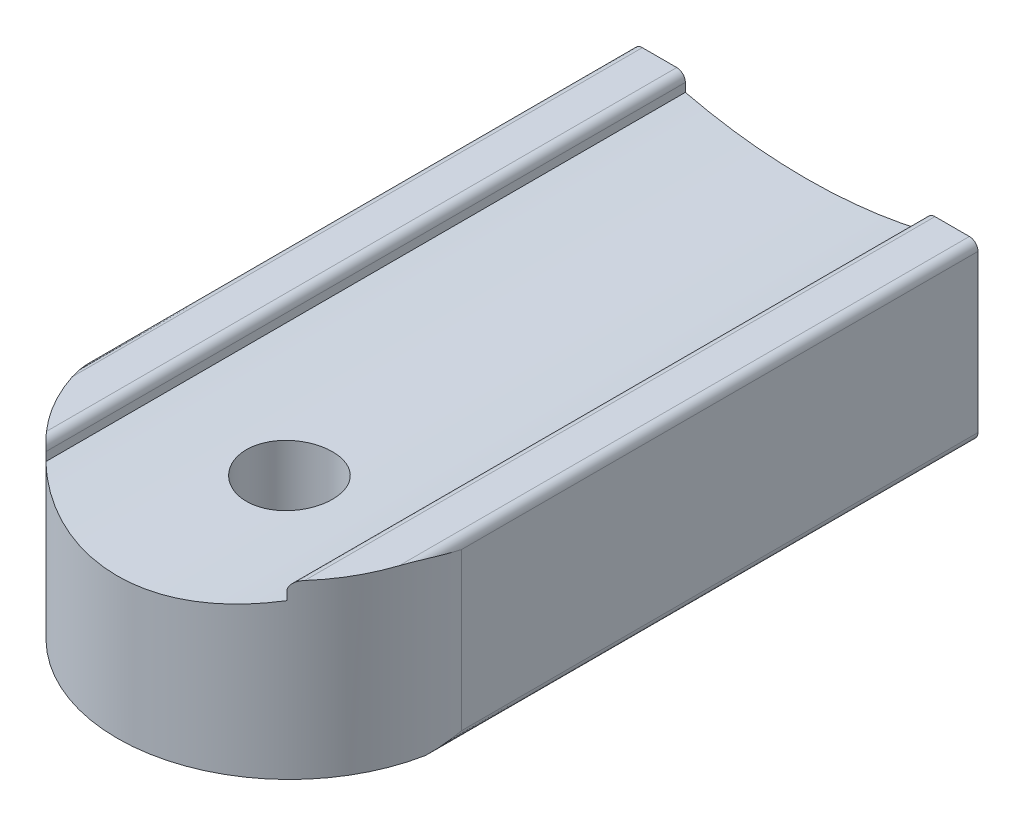
from build123d import *

# Parameters (mm, degrees)
SALIENTE_EXTRUIR1_DEPTH = 40
CROQUIS2_R              = 2.5
CORTAR_EXTRUIR1_DEPTH   = 22.5
CORTAR_EXTRUIR5_DEPTH   = 14
CROQUIS6_R              = 4
CROQUIS6_R_2            = 2.5
SALIENTE_EXTRUIR2_DEPTH = 1


with BuildPart() as part:
    # Croquis1 → Saliente-Extruir1 (new body)
    with BuildSketch(Plane.XY):
        with BuildLine():
            ThreePointArc((-13.23096405, 11.648445498), (-13.584517441, 11.501998889), (-13.73096405, 11.148445498))
            Line((-13.73096405, 11.148445498), (-13.73096405, 2.035658412))
            ThreePointArc((-13.73096405, 2.035658412), (-13.626281451, 1.729514406), (-13.356067441, 1.551562201))
            Line((-13.356067441, 1.551562201), (-12.169475815, 1.244915231))
            ThreePointArc((-12.169475815, 1.244915231), (-11.899261805, 1.066963026), (-11.794579206, 0.76081902))
            Line((-11.794579206, 0.76081902), (-11.794579206, 0.442917518))
            ThreePointArc((-11.794579206, 0.442917518), (-11.736179814, 0.265071669), (-11.583718232, 0.156466416))
            ThreePointArc((-11.583718232, 0.156466416), (-7.701884055, -0.773383829), (-3.73096405, -1.17965021))
            ThreePointArc((-3.73096405, -1.17965021), (0.239955955, -0.773383829), (4.121790132, 0.156466416))
            ThreePointArc((4.121790132, 0.156466416), (4.274251714, 0.265071669), (4.332651106, 0.442917518))
            Line((4.332651106, 0.442917518), (4.332651106, 0.76081902))
            ThreePointArc((4.332651106, 0.76081902), (4.437333704, 1.066963026), (4.707547715, 1.244915231))
            Line((4.707547715, 1.244915231), (5.894139341, 1.551562201))
            ThreePointArc((5.894139341, 1.551562201), (6.164353351, 1.729514406), (6.26903595, 2.035658412))
            Line((6.26903595, 2.035658412), (6.26903595, 11.148445498))
            ThreePointArc((6.26903595, 11.148445498), (6.12258934, 11.501998889), (5.76903595, 11.648445498))
            Line((5.76903595, 11.648445498), (3.76903595, 11.648445498))
            ThreePointArc((3.76903595, 11.648445498), (3.415482559, 11.501998889), (3.26903595, 11.148445498))
            Line((3.26903595, 11.148445498), (3.26903595, 10.648445498))
            ThreePointArc((3.26903595, 10.648445498), (-0.206558338, 10.028093004), (-3.73096405, 9.82034979))
            ThreePointArc((-3.73096405, 9.82034979), (-7.255369763, 10.028093004), (-10.73096405, 10.648445498))
            Line((-10.73096405, 10.648445498), (-10.73096405, 11.148445498))
            ThreePointArc((-10.73096405, 11.148445498), (-10.87741066, 11.501998889), (-11.23096405, 11.648445498))
            Line((-11.23096405, 11.648445498), (-13.23096405, 11.648445498))
        make_face()
    extrude(amount=SALIENTE_EXTRUIR1_DEPTH)

    # Croquis2 → Cortar-Extruir1 (cut, symmetric)
    with BuildSketch(Plane(origin=(0, 0, 0), x_dir=(1, 0, 0), z_dir=(0, 1, 0))):
        with Locations(Location((-3.73096405, -30, 0), (0, 0, 90))):
            Circle(CROQUIS2_R)
        with BuildLine():
            Line((-13.73096405, -30), (-13.73096405, -43.289358514))
            Line((-13.73096405, -43.289358514), (6.26903595, -43.289358514))
            Line((6.26903595, -43.289358514), (6.26903595, -30))
            ThreePointArc((6.26903595, -30), (-3.73096405, -40), (-13.73096405, -30))
        make_face()
    extrude(amount=CORTAR_EXTRUIR1_DEPTH, both=True, mode=Mode.SUBTRACT)

    # Croquis5 → Cortar-Extruir5 (cut)
    with BuildSketch(Plane(origin=(0, 1.648445498, 0), x_dir=(1, 0, 0), z_dir=(0, 1, 0))):
        with BuildLine():
            Line((-13.73096405, 0), (-13.73096405, -40.777418578))
            Line((-13.73096405, -40.777418578), (6.26903595, -40.777418578))
            Line((6.26903595, -40.777418578), (6.26903595, 0))
            ThreePointArc((6.26903595, 0), (-3.73096405, -10), (-13.73096405, 0))
        make_face()
    extrude(amount=-CORTAR_EXTRUIR5_DEPTH, mode=Mode.SUBTRACT)

    # Croquis6 → Saliente-Extruir2 (add)
    with BuildSketch(Plane.XZ.offset(-1.648445498)):
        with Locations(Location((-3.73096405, 30, 0), (0, 0, 180))):
            Circle(CROQUIS6_R)
        with Locations(Location((-3.73096405, 30, 0), (0, 0, 270))):
            Circle(CROQUIS6_R_2, mode=Mode.SUBTRACT)
    extrude(amount=SALIENTE_EXTRUIR2_DEPTH)


solid = part.part
